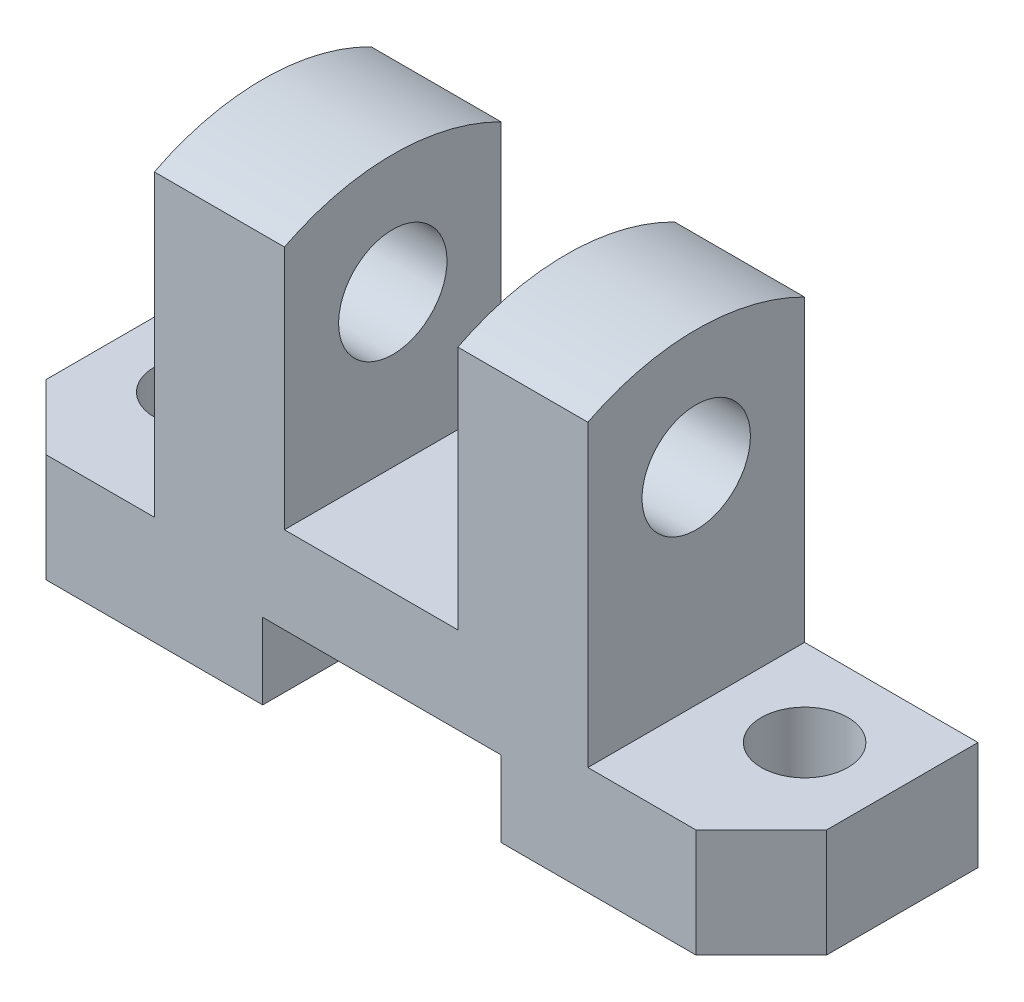
from build123d import *

# Parameters (mm, degrees)
ESQUISSE1_W                       = 114.3
ESQUISSE1_H                       = 63.5
BASE_EXTRUSION_DEPTH              = 15.875
ESQUISSE2_W                       = 25.4
ESQUISSE2_H                       = 47.625
ESQUISSE2_H_2                     = 39.6875
ESQUISSE2_W_2                     = 34.925
ESQUISSE2_H_3                     = 11.1125
ENL_V_MAT_EXTRU_1_DEPTH           = 135.554087638
ENL_V_MAT_EXTRU_2_DEPTH           = 111.396900432
CHANFREIN1_SIZE                   = 9.525
DIAM_TRE_DU_PER_AGE_1_2_0_5_1_D   = 12.7
DIAM_TRE_DU_PER_AGE_5_8_0_625_1_D = 15.875


with BuildPart() as part:
    # Esquisse1 → Base-Extrusion (new, symmetric)
    with BuildSketch(Plane.XY):
        with Locations((57.15, 31.75)):
            Rectangle(ESQUISSE1_W, ESQUISSE1_H)
    extrude(amount=BASE_EXTRUSION_DEPTH, both=True)

    # Esquisse2 → Enlèv. mat.-Extru.1 (cut, through all)
    with BuildSketch(Plane.XY.offset(15.875)):
        with Locations((12.7, 39.6875)):
            Rectangle(ESQUISSE2_W, ESQUISSE2_H)
        with Locations((101.6, 39.6875)):
            Rectangle(ESQUISSE2_W, ESQUISSE2_H)
        with Locations((57.15, 43.65625)):
            Rectangle(ESQUISSE2_W, ESQUISSE2_H_2)
        with Locations((58.7375, 5.55625)):
            Rectangle(ESQUISSE2_W_2, ESQUISSE2_H_3)
    extrude(amount=-ENL_V_MAT_EXTRU_1_DEPTH, mode=Mode.SUBTRACT)

    # Esquisse3 → Enlèv. mat.-Extru.2 (cut, through all)
    with BuildSketch(Plane(origin=(88.9, 0, 0), x_dir=(0, 0, -1), z_dir=(1, 0, 0))):
        with BuildLine():
            Line((-34.925, 68.575), (-34.925, 28.575))
            ThreePointArc((-34.925, 28.575), (0, 63.5), (34.925, 28.575))
            Line((34.925, 28.575), (34.925, 68.575))
            Line((34.925, 68.575), (-34.925, 68.575))
        make_face()
    extrude(amount=-ENL_V_MAT_EXTRU_2_DEPTH, mode=Mode.SUBTRACT)

    # Chanfrein1
    chanfrein1_edges = [part.edges().sort_by_distance(p)[0] for p in [
        (114.3, 7.9375, 15.875),
        (0, 7.9375, 15.875),
    ]]
    chamfer(chanfrein1_edges, length=CHANFREIN1_SIZE)

    # Diamètre du perçage 1/2 (0.5)1 (through all)
    with Locations(Plane(origin=(0, 15.875, 0), x_dir=(1, 0, 0), z_dir=(0, 1, 0))):
        with Locations((101.6, 3.175), (12.7, 3.175)):
            Hole(DIAM_TRE_DU_PER_AGE_1_2_0_5_1_D / 2)

    # Diamètre du perçage 5/8 (0.625)1 (through all)
    with Locations(Plane(origin=(88.9, 0, 0), x_dir=(0, 0, -1), z_dir=(1, 0, 0))):
        with Locations((0, 46.0375)):
            Hole(DIAM_TRE_DU_PER_AGE_5_8_0_625_1_D / 2)


solid = part.part
